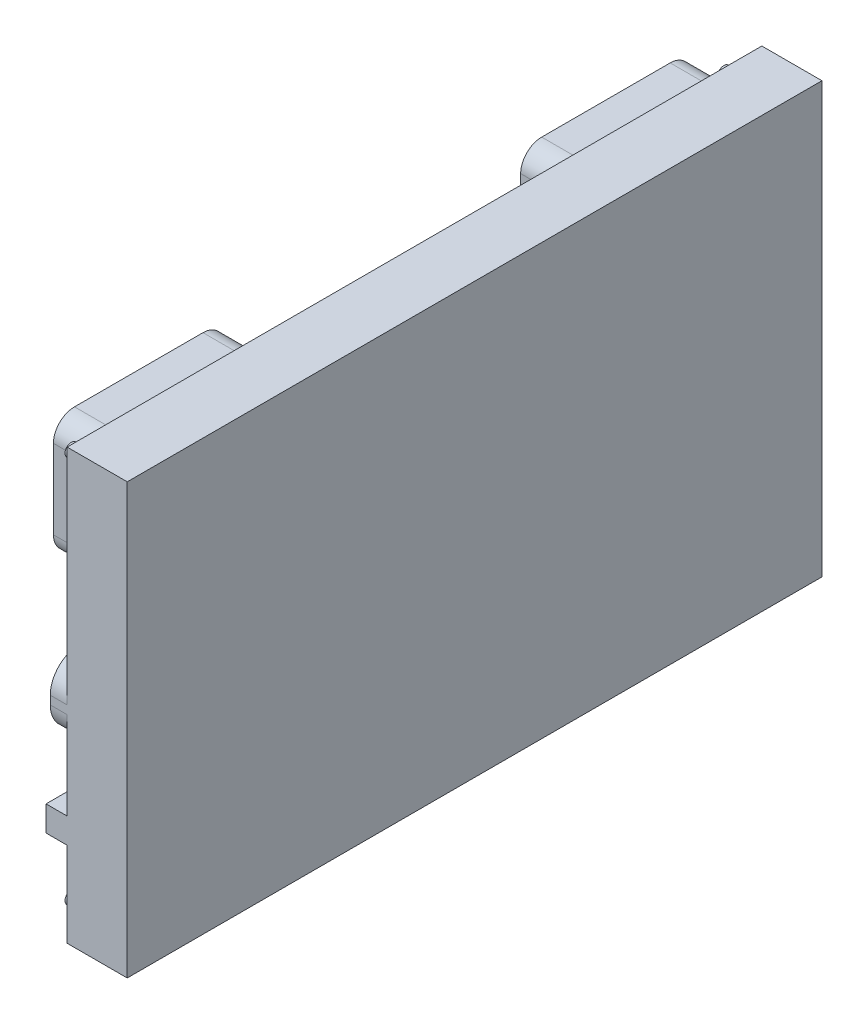
from build123d import *

# Parameters (mm, degrees)
CROQUIS1_W              = 164.9
CROQUIS1_H              = 102
SALIENTE_EXTRUIR1_DEPTH = 14.27
CROQUIS2_W              = 11
CROQUIS2_H              = 15
SALIENTE_EXTRUIR3_DEPTH = 6
CROQUIS3_W              = 6
CROQUIS3_H              = 7
SALIENTE_EXTRUIR4_DEPTH = 3
CROQUIS4_W              = 15
CROQUIS4_H              = 6
SALIENTE_EXTRUIR5_DEPTH = 5
SALIENTE_EXTRUIR6_DEPTH = 10
SALIENTE_EXTRUIR7_DEPTH = 4
CROQUIS7_R              = 1.5
SALIENTE_EXTRUIR8_DEPTH = 4


with BuildPart() as part:
    # Croquis1 → Saliente-Extruir1 (new body)
    with BuildSketch(Plane(origin=(0, 0, 0), x_dir=(0, 0, -1), z_dir=(1, 0, 0))):
        with Locations((10.245979532, -7.846345029)):
            Rectangle(CROQUIS1_W, CROQUIS1_H)
    extrude(amount=SALIENTE_EXTRUIR1_DEPTH)

    # Croquis2 → Saliente-Extruir3 (add)
    with BuildSketch(Plane.ZY):
        with Locations((-87.195979532, 1.653654971)):
            Rectangle(CROQUIS2_W, CROQUIS2_H)
    extrude(amount=SALIENTE_EXTRUIR3_DEPTH)

    # Croquis3 → Saliente-Extruir4 (add)
    with BuildSketch(Plane.ZY):
        with Locations((-89.695979532, -36.846345029)):
            Rectangle(CROQUIS3_W, CROQUIS3_H)
        with Locations((-89.695979532, -18.846345029)):
            Rectangle(CROQUIS3_W, CROQUIS3_H)
    extrude(amount=SALIENTE_EXTRUIR4_DEPTH)

    # Croquis4 → Saliente-Extruir5 (add)
    with BuildSketch(Plane.ZY):
        with Locations((64.704020468, -35.686345029)):
            Rectangle(CROQUIS4_W, CROQUIS4_H)
    extrude(amount=SALIENTE_EXTRUIR5_DEPTH)

    # Croquis5 → Saliente-Extruir6 (add)
    with BuildSketch(Plane.ZY):
        with BuildLine():
            Line((-80.945979532, 40.553654971), (-50.445979532, 40.553654971))
            ThreePointArc((-50.445979532, 40.553654971), (-46.910445626, 39.089188877), (-45.445979532, 35.553654971))
            Line((-45.445979532, 35.553654971), (-45.445979532, 16.753654971))
            ThreePointArc((-45.445979532, 16.753654971), (-46.910445626, 13.218121065), (-50.445979532, 11.753654971))
            Line((-50.445979532, 11.753654971), (-80.945979532, 11.753654971))
            ThreePointArc((-80.945979532, 11.753654971), (-84.481513438, 13.218121065), (-85.945979532, 16.753654971))
            Line((-85.945979532, 16.753654971), (-85.945979532, 35.553654971))
            ThreePointArc((-85.945979532, 35.553654971), (-84.481513438, 39.089188877), (-80.945979532, 40.553654971))
        make_face()
        with BuildLine():
            Line((29.954020468, 40.553654971), (60.454020468, 40.553654971))
            ThreePointArc((60.454020468, 40.553654971), (63.989554374, 39.089188877), (65.454020468, 35.553654971))
            Line((65.454020468, 35.553654971), (65.454020468, 16.753654971))
            ThreePointArc((65.454020468, 16.753654971), (63.989554374, 13.218121065), (60.454020468, 11.753654971))
            Line((60.454020468, 11.753654971), (29.954020468, 11.753654971))
            ThreePointArc((29.954020468, 11.753654971), (26.418486562, 13.218121065), (24.954020468, 16.753654971))
            Line((24.954020468, 16.753654971), (24.954020468, 35.553654971))
            ThreePointArc((24.954020468, 35.553654971), (26.418486562, 39.089188877), (29.954020468, 40.553654971))
        make_face()
    extrude(amount=SALIENTE_EXTRUIR6_DEPTH)

    # Croquis6 → Saliente-Extruir7 (add)
    with BuildSketch(Plane.ZY):
        with BuildLine():
            Line((58.204020468, -2.846345029), (65.204020468, -2.846345029))
            ThreePointArc((65.204020468, -2.846345029), (70.153767936, -4.896597561), (72.204020468, -9.846345029))
            Line((72.204020468, -9.846345029), (72.204020468, -11.846345029))
            ThreePointArc((72.204020468, -11.846345029), (70.153767936, -16.796092498), (65.204020468, -18.846345029))
            Line((65.204020468, -18.846345029), (58.204020468, -18.846345029))
            Line((58.204020468, -18.846345029), (58.204020468, -2.846345029))
        make_face()
    extrude(amount=SALIENTE_EXTRUIR7_DEPTH)

    # Croquis7 → Saliente-Extruir8 (add)
    with BuildSketch(Plane.ZY):
        with Locations(Location((-87.690979532, 38.153654971, 0), (0, 0, 180))):
            Circle(CROQUIS7_R)
        with Locations(Location((67.204020468, 38.153654971, 0), (0, 0, 180))):
            Circle(CROQUIS7_R)
        with Locations(Location((-87.695979532, -53.846345029, 0), (0, 0, 180))):
            Circle(CROQUIS7_R)
        with Locations(Location((67.204020468, -53.846345029, 0), (0, 0, 180))):
            Circle(CROQUIS7_R)
    extrude(amount=SALIENTE_EXTRUIR8_DEPTH)


solid = part.part
